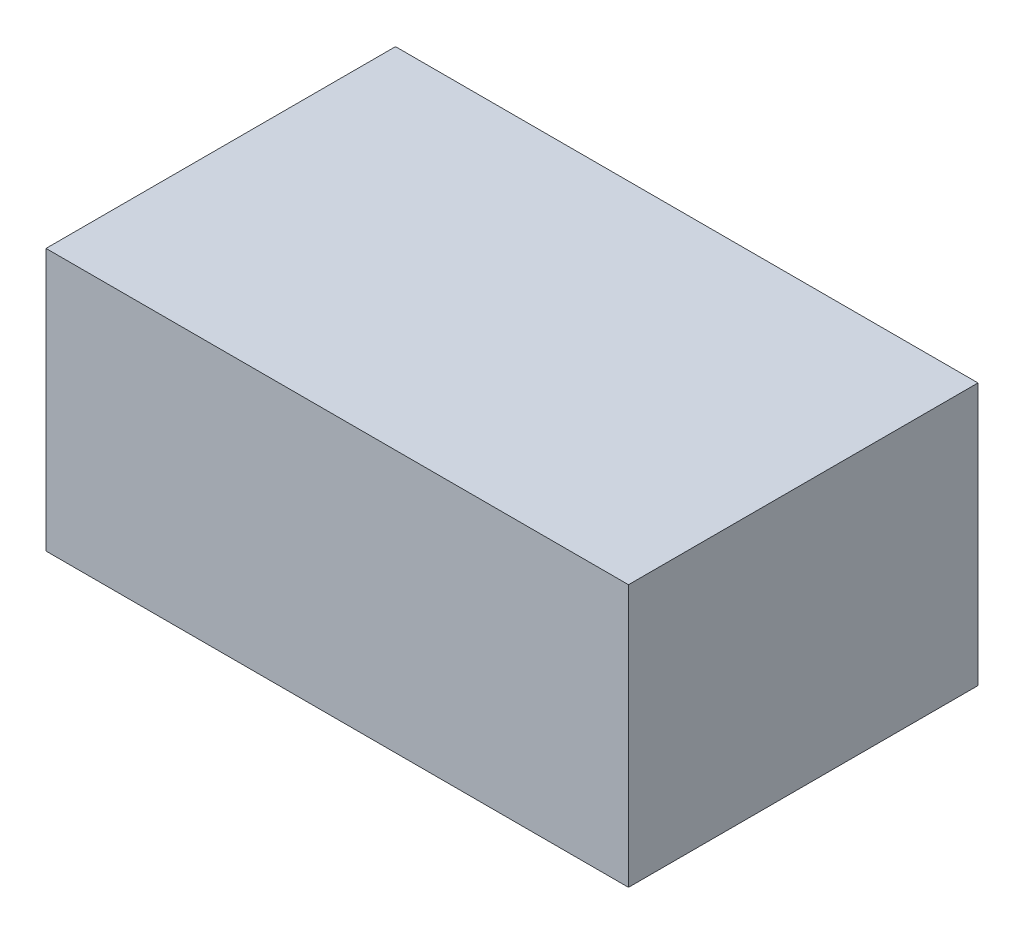
from build123d import *

# Parameters (mm, degrees)
SKETCH1_W           = 400
SKETCH1_H           = 240
BOSS_EXTRUDE1_DEPTH = 180


with BuildPart() as part:
    # Sketch1 → Boss-Extrude1 (new body)
    with BuildSketch(Plane(origin=(0, 0, 0), x_dir=(1, 0, 0), z_dir=(0, 1, 0))):
        with Locations((21.413693799, 7.613293051)):
            Rectangle(SKETCH1_W, SKETCH1_H)
    extrude(amount=BOSS_EXTRUDE1_DEPTH)


solid = part.part
